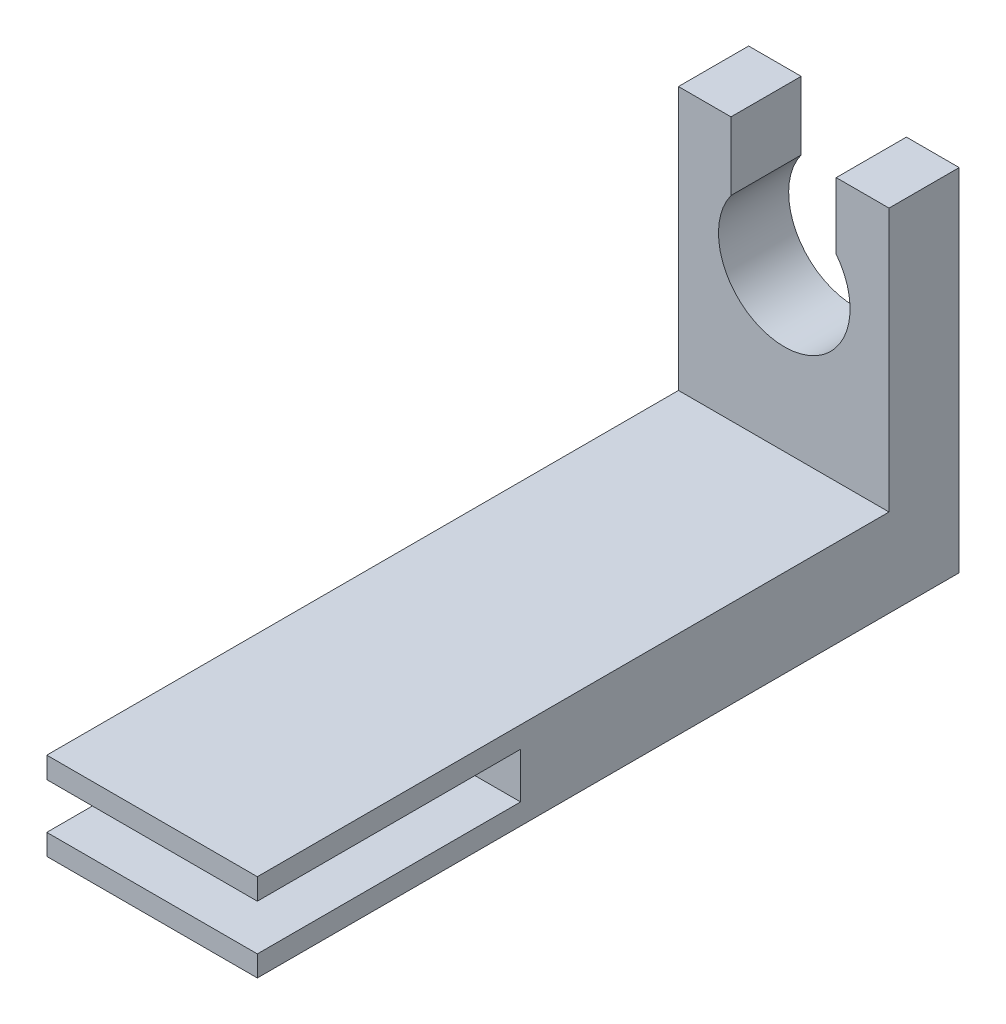
from build123d import *

# Parameters (mm, degrees)
SKETCH2_W           = 12
SKETCH2_H           = 40
BOSS_EXTRUDE1_DEPTH = 5
SKETCH3_W           = 12.004104261
SKETCH3_H           = 2.6
CUT_EXTRUDE1_DEPTH  = 15
SKETCH4_W           = 12
SKETCH4_H           = 4
BOSS_EXTRUDE2_DEPTH = 15
SKETCH5_R           = 3.75
CUT_EXTRUDE2_DEPTH  = 15
SKETCH6_W           = 5.997636367
SKETCH6_H           = 3.881980202
CUT_EXTRUDE3_DEPTH  = 10


with BuildPart() as part:
    # Sketch2 → Boss-Extrude1 (new body)
    with BuildSketch(Plane(origin=(0, 0, 0), x_dir=(1, 0, 0), z_dir=(0, 1, 0))):
        with Locations((-9.764705882, 23.058823529)):
            Rectangle(SKETCH2_W, SKETCH2_H)
    extrude(amount=BOSS_EXTRUDE1_DEPTH)

    # Sketch3 → Cut-Extrude1 (cut)
    with BuildSketch(Plane.XY.offset(-3.058823529)):
        with Locations((-9.766758013, 2.489565118)):
            Rectangle(SKETCH3_W, SKETCH3_H)
    extrude(amount=-CUT_EXTRUDE1_DEPTH, mode=Mode.SUBTRACT)

    # Sketch4 → Boss-Extrude2 (add)
    with BuildSketch(Plane(origin=(0, 5, 0), x_dir=(1, 0, 0), z_dir=(0, 1, 0))):
        with Locations((-9.764705882, 41.058823529)):
            Rectangle(SKETCH4_W, SKETCH4_H)
    extrude(amount=BOSS_EXTRUDE2_DEPTH)

    # Sketch5 → Cut-Extrude2 (cut)
    with BuildSketch(Plane(origin=(0, 0, -43.058823529), x_dir=(-1, 0, 0), z_dir=(0, 0, -1))):
        with Locations((9.734798195, 13.917907096)):
            Circle(SKETCH5_R)
    extrude(amount=-CUT_EXTRUDE2_DEPTH, mode=Mode.SUBTRACT)

    # Sketch6 → Cut-Extrude3 (cut)
    with BuildSketch(Plane(origin=(0, 0, -43.058823529), x_dir=(-1, 0, 0), z_dir=(0, 0, -1))):
        with Locations((9.772755291, 18.059009899)):
            Rectangle(SKETCH6_W, SKETCH6_H)
    extrude(amount=-CUT_EXTRUDE3_DEPTH, mode=Mode.SUBTRACT)


solid = part.part
